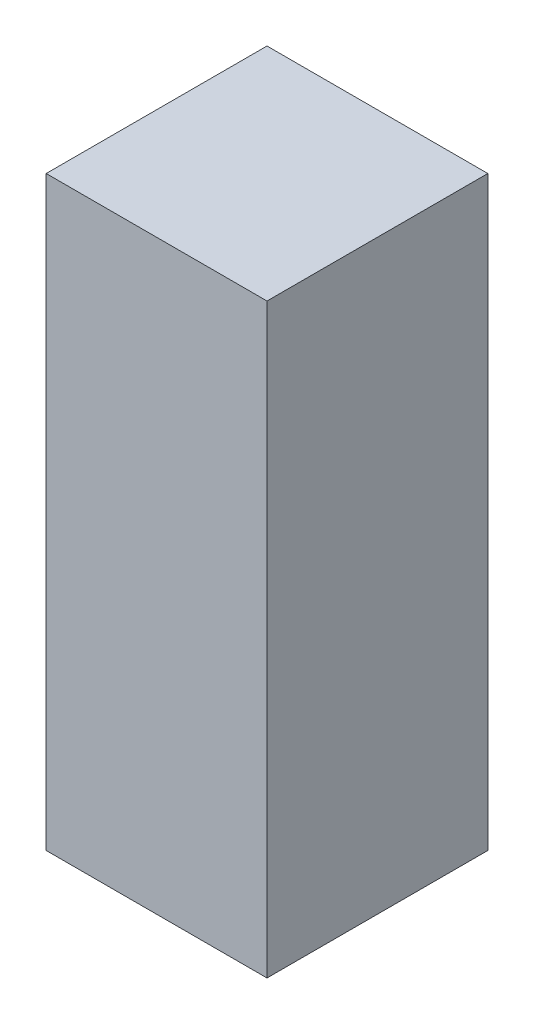
from build123d import *

# Parameters (mm, degrees)
SKETCH1_W           = 50.8
SKETCH1_H           = 50.8
BOSS_EXTRUDE1_DEPTH = 134.874


with BuildPart() as part:
    # Sketch1 → Boss-Extrude1 (new body)
    with BuildSketch(Plane(origin=(0, 0, 0), x_dir=(1, 0, 0), z_dir=(0, 1, 0))):
        Rectangle(SKETCH1_W, SKETCH1_H)
    extrude(amount=BOSS_EXTRUDE1_DEPTH)


solid = part.part
